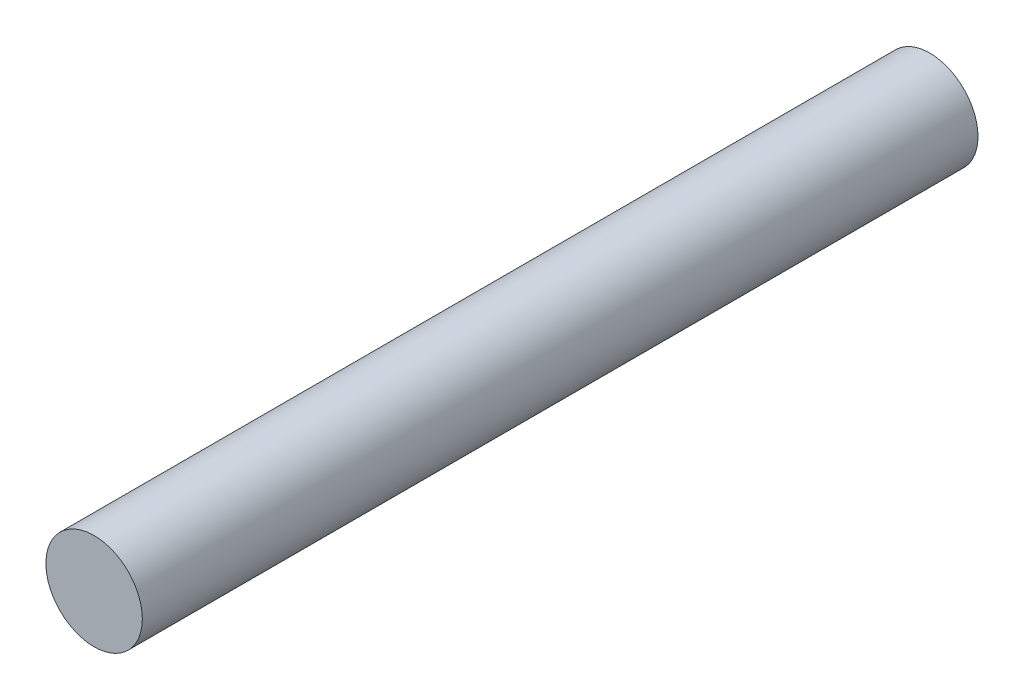
from build123d import *

# Parameters (mm, degrees)
SKETCH1_R           = 7.5
BOSS_EXTRUDE1_DEPTH = 130


with BuildPart() as part:
    # Sketch1 → Boss-Extrude1 (new body)
    with BuildSketch(Plane.XY):
        Circle(SKETCH1_R)
    extrude(amount=BOSS_EXTRUDE1_DEPTH)


solid = part.part
